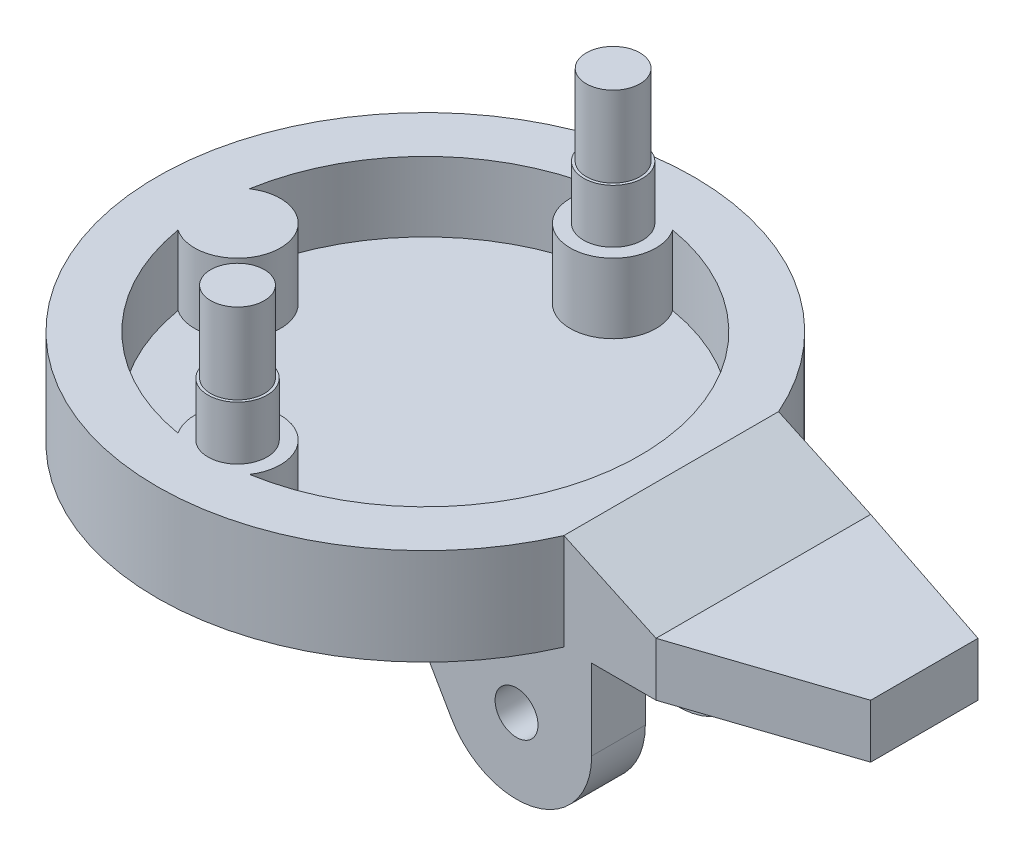
from build123d import *

# Parameters (mm, degrees)
SKETCH1_R                = 50
BOSS_EXTRUDE1_DEPTH      = 18
CUT_EXTRUDE1_START       = 5
CUT_EXTRUDE1_DEPTH       = 68.965745388
BOSS_EXTRUDE2_START      = 18
SKETCH1_4_R              = 5.5
BOSS_EXTRUDE2_DEPTH      = 10
BOSS_EXTRUDE3_START      = 28
SKETCH1_5_R              = 5
BOSS_EXTRUDE3_DEPTH      = 15
SKETCH3_R                = 4
CUT_EXTRUDE2_DEPTH       = 18
SKETCH3_3_R              = 4
CUT_EXTRUDE3_DEPTH       = 8
BOSS_EXTRUDE4_REACH      = 159.474
BOSS_EXTRUDE4_END_RADIUS = 50
SKETCH5_W                = 40
SKETCH5_H                = 18
CUT_EXTRUDE4_DEPTH       = 125.088677969
CUT_EXTRUDE5_DEPTH       = 111.625494349
BOSS_EXTRUDE5_START      = 10
SKETCH8_R                = 4
BOSS_EXTRUDE5_DEPTH      = 10


with BuildPart() as part:
    # Sketch1 → Boss-Extrude1 (new body)
    with BuildSketch(Plane(origin=(0, 0, 0), x_dir=(1, 0, 0), z_dir=(0, 1, 0))):
        with Locations(Location((0, 0, 0), (0, 0, 270))):
            Circle(SKETCH1_R)
    extrude(amount=BOSS_EXTRUDE1_DEPTH)

    # Sketch1<3> → Cut-Extrude1 (cut, through all)
    with BuildSketch(Plane(origin=(0, 0, 0), x_dir=(1, 0, 0), z_dir=(0, 1, 0)).offset(CUT_EXTRUDE1_START)):
        with BuildLine():
            ThreePointArc((6.652895641, -39.442857143), (30.545996674, -25.825221919), (40, 0))
            ThreePointArc((40, 0), (30.545996674, 25.825221919), (6.652895641, 39.442857143))
            ThreePointArc((6.652895641, 39.442857143), (7.655820176, 37.321296499), (8, 35))
            ThreePointArc((8, 35), (-2.321296499, 27.344179824), (-6.652895641, 39.442857143))
            ThreePointArc((-6.652895641, 39.442857143), (-28.284271247, 28.284271247), (-39.442857143, 6.652895641))
            ThreePointArc((-39.442857143, 6.652895641), (-31.227922134, 7.054886857), (-27, 0))
            ThreePointArc((-27, 0), (-31.227922134, -7.054886857), (-39.442857143, -6.652895641))
            ThreePointArc((-39.442857143, -6.652895641), (-28.284271247, -28.284271247), (-6.652895641, -39.442857143))
            ThreePointArc((-6.652895641, -39.442857143), (-2.321296499, -27.344179824), (8, -35))
            ThreePointArc((8, -35), (7.655820176, -37.321296499), (6.652895641, -39.442857143))
        make_face()
    extrude(amount=CUT_EXTRUDE1_DEPTH, mode=Mode.SUBTRACT)

    # Sketch1<4> → Boss-Extrude2 (add)
    with BuildSketch(Plane(origin=(0, 0, 0), x_dir=(1, 0, 0), z_dir=(0, 1, 0)).offset(BOSS_EXTRUDE2_START)):
        with Locations(Location((0, 35, 0), (0, 0, 270))):
            Circle(SKETCH1_4_R)
        with Locations(Location((0, -35, 0), (0, 0, 270))):
            Circle(SKETCH1_4_R)
    extrude(amount=BOSS_EXTRUDE2_DEPTH)

    # Sketch1<5> → Boss-Extrude3 (add)
    with BuildSketch(Plane(origin=(0, 0, 0), x_dir=(1, 0, 0), z_dir=(0, 1, 0)).offset(BOSS_EXTRUDE3_START)):
        with Locations(Location((0, 35, 0), (0, 0, 270))):
            Circle(SKETCH1_5_R)
        with Locations(Location((0, -35, 0), (0, 0, 270))):
            Circle(SKETCH1_5_R)
    extrude(amount=BOSS_EXTRUDE3_DEPTH)

    # Sketch3 → Cut-Extrude2 (cut)
    with BuildSketch(Plane.XZ):
        with Locations(Location((0, 35, 0), (0, 0, 270))):
            Circle(SKETCH3_R)
        with Locations(Location((0, -35, 0), (0, 0, 270))):
            Circle(SKETCH3_R)
    extrude(amount=-CUT_EXTRUDE2_DEPTH, mode=Mode.SUBTRACT)

    # Sketch3<3> → Cut-Extrude3 (cut)
    with BuildSketch(Plane.XZ):
        with Locations(Location((-35, 0, 0), (0, 0, 270))):
            Circle(SKETCH3_3_R)
    extrude(amount=-CUT_EXTRUDE3_DEPTH, mode=Mode.SUBTRACT)

    # Boss-Extrude4: up to this cylinder (the profile starts outside it)
    boss_extrude4_end = Plane(origin=(0, 9, 0), z_dir=(0, -1, 0)) * Cylinder(BOSS_EXTRUDE4_END_RADIUS, 419.948, mode=Mode.PRIVATE)
    # Sketch5 → Boss-Extrude4 (add, up to the surface)
    with BuildSketch(Plane(origin=(93, 0, 0), x_dir=(0, 0, -1), z_dir=(1, 0, 0)), mode=Mode.PRIVATE) as boss_extrude4_sk1:
        with Locations((0, 9)):
            Rectangle(SKETCH5_W, SKETCH5_H)
    boss_extrude4_tool1 = extrude(boss_extrude4_sk1.sketch, amount=-BOSS_EXTRUDE4_REACH, mode=Mode.PRIVATE) - boss_extrude4_end
    add(boss_extrude4_tool1.solids().sort_by_distance((93, 9, 0))[0])

    # Sketch6 → Cut-Extrude4 (cut, through all)
    with BuildSketch(Plane.XY.offset(20)):
        Polygon((93, 10), (63, 10), (45.82575695, 18), (93, 18), align=None)
    extrude(amount=-CUT_EXTRUDE4_DEPTH, mode=Mode.SUBTRACT)

    # Sketch7 → Cut-Extrude5 (cut, through all)
    with BuildSketch(Plane(origin=(0, 10, 0), x_dir=(1, 0, 0), z_dir=(0, 1, 0))):
        Polygon((63, 20), (93, 10), (93, 20), align=None)
        Polygon((93, -10), (93, -20), (63, -20), align=None)
    extrude(amount=-CUT_EXTRUDE5_DEPTH, mode=Mode.SUBTRACT)

    # Sketch8 → Boss-Extrude5 (add)
    with BuildSketch(Plane.XY.offset(BOSS_EXTRUDE5_START)):
        with BuildLine():
            Line((12.173938425, 0), (24.875644347, -22))
            ThreePointArc((24.875644347, -22), (40.623466631, -28.522961568), (51, -15))
            Line((51, -15), (51, 0))
            Line((51, 0), (12.173938425, 0))
        make_face()
        with Locations((37, -15)):
            Circle(SKETCH8_R, mode=Mode.SUBTRACT)
    boss_extrude5 = extrude(amount=BOSS_EXTRUDE5_DEPTH)

    # Mirror1: Boss-Extrude5 across plane
    add(boss_extrude5.mirror(Plane.XY))


solid = part.part
